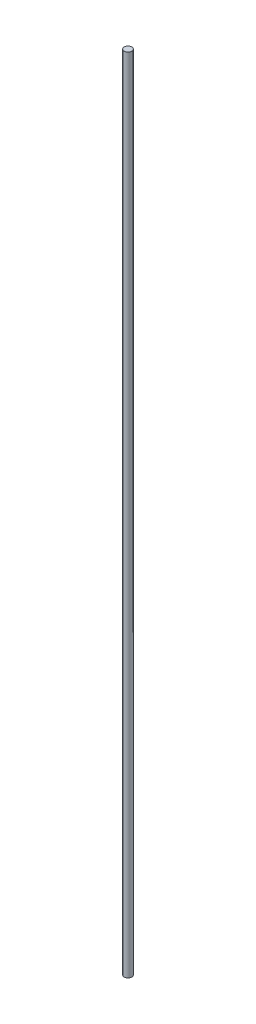
from build123d import *

# Parameters (mm, degrees)
SKETCH1_R           = 9.5
BOSS_EXTRUDE1_DEPTH = 2025


with BuildPart() as part:
    # Sketch1 → Boss-Extrude1 (new body)
    with BuildSketch(Plane(origin=(0, 0, 0), x_dir=(1, 0, 0), z_dir=(0, 1, 0))):
        with Locations(Location((0, 0, 0), (0, 0, 270))):
            Circle(SKETCH1_R)
    extrude(amount=BOSS_EXTRUDE1_DEPTH)


solid = part.part
